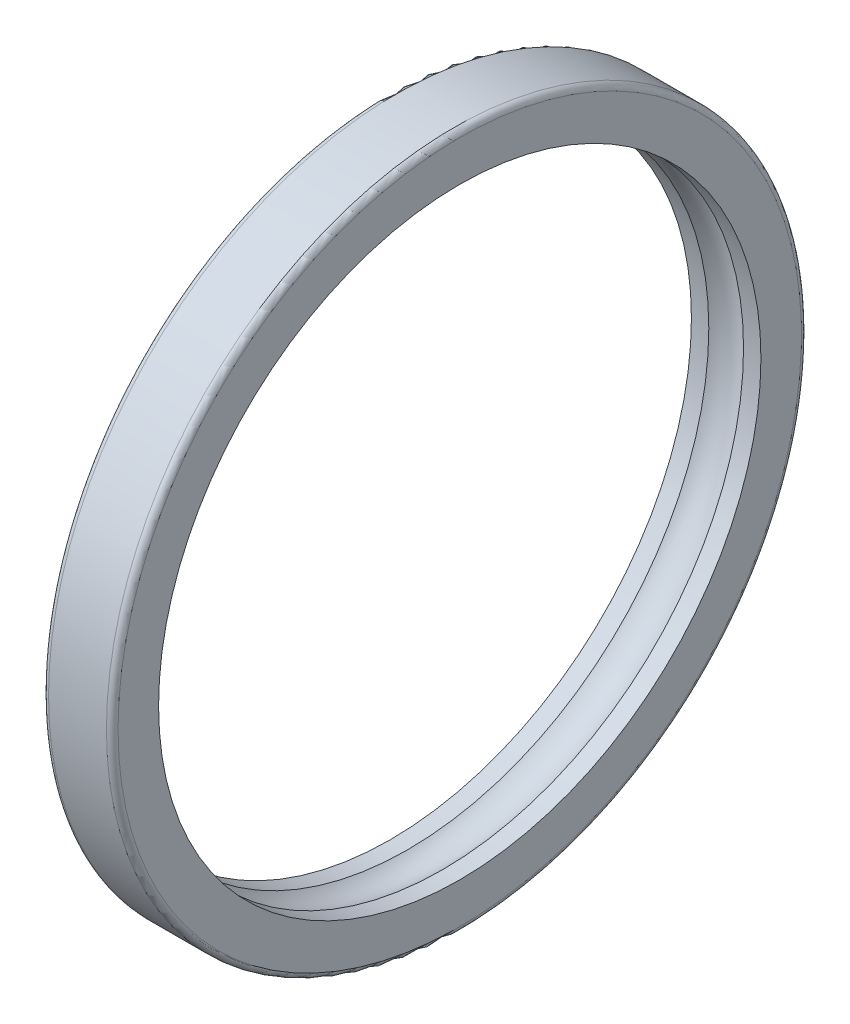
from build123d import *

# Parameters (mm, degrees)
FILLET1_R = 0.635


with BuildPart() as part:
    # Sketch1 → Revolve2 (revolve)
    with BuildSketch(Plane.XY, mode=Mode.PRIVATE) as revolve2_sk:
        with BuildLine():
            Line((3.81, 38.1), (-3.81, 38.1))
            Line((-3.81, 38.1), (-3.81, 33.02))
            Line((-3.81, 33.02), (-1.905, 33.02))
            ThreePointArc((-1.905, 33.02), (0, 33.655), (1.905, 33.02))
            Line((1.905, 33.02), (3.81, 33.02))
            Line((3.81, 33.02), (3.81, 38.1))
        make_face()
    revolve(revolve2_sk.sketch.rotate(Axis((-3.81, 0, 0), (1, 0, 0)), 90), axis=Axis((-3.81, 0, 0), (1, 0, 0)))

    # Fillet1
    fillet1_edges = [part.edges().sort_by_distance(p)[0] for p in [
        (3.81, 0, -38.1),
        (-3.81, 0, -38.1),
    ]]
    fillet(fillet1_edges, radius=FILLET1_R)


solid = part.part
